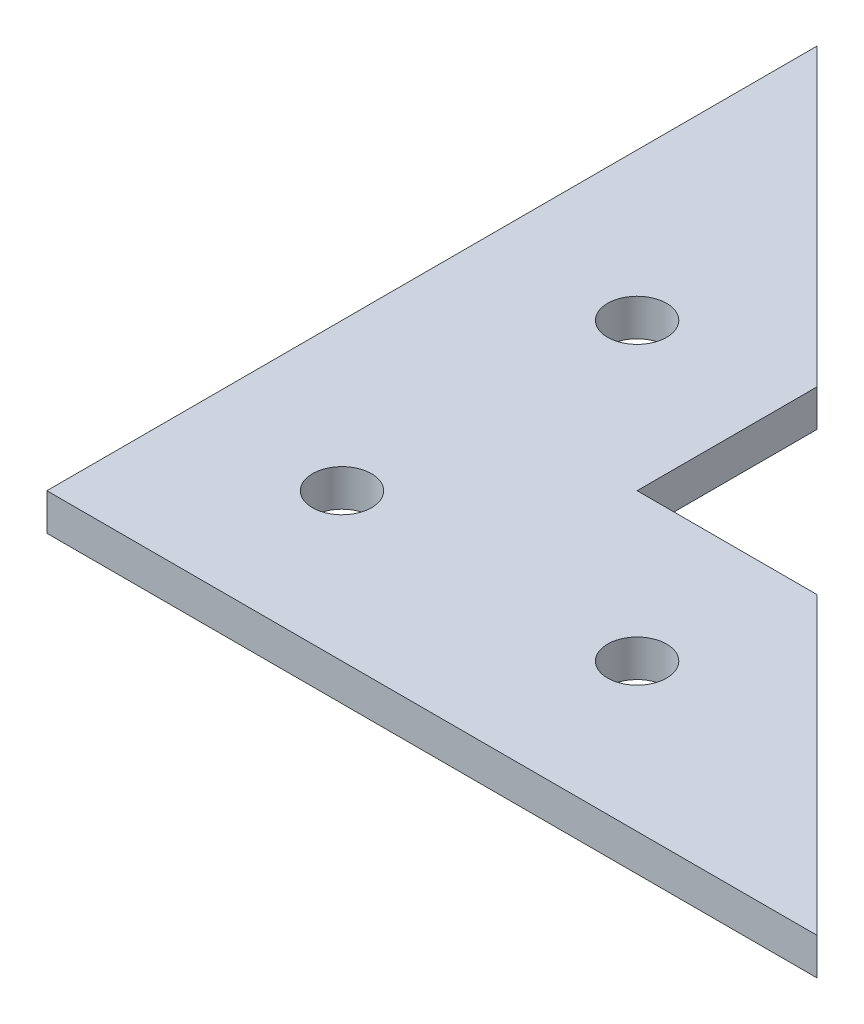
from build123d import *

# Parameters (mm, degrees)
SKETCH2_R           = 2.54
BOSS_EXTRUDE1_DEPTH = 3.175


with BuildPart() as part:
    # Sketch2 → Boss-Extrude1 (new body)
    with BuildSketch(Plane(origin=(0, 0, 0), x_dir=(1, 0, 0), z_dir=(0, 1, 0))):
        Polygon((52.699376197, -13.643599401), (78.099376197, -39.043599401), (78.099376197, -54.537599401), (93.593376197, -54.537599401), (118.993376197, -79.937599401), (52.699376197, -79.937599401), align=None)
        with Locations(Location((65.399376197, -67.237599401, 0), (0, 0, 270))):
            Circle(SKETCH2_R, mode=Mode.SUBTRACT)
        with Locations(Location((90.799376197, -67.237599401, 0), (0, 0, 270))):
            Circle(SKETCH2_R, mode=Mode.SUBTRACT)
        with Locations(Location((65.399376197, -41.837599401, 0), (0, 0, 270))):
            Circle(SKETCH2_R, mode=Mode.SUBTRACT)
    extrude(amount=BOSS_EXTRUDE1_DEPTH)


solid = part.part
